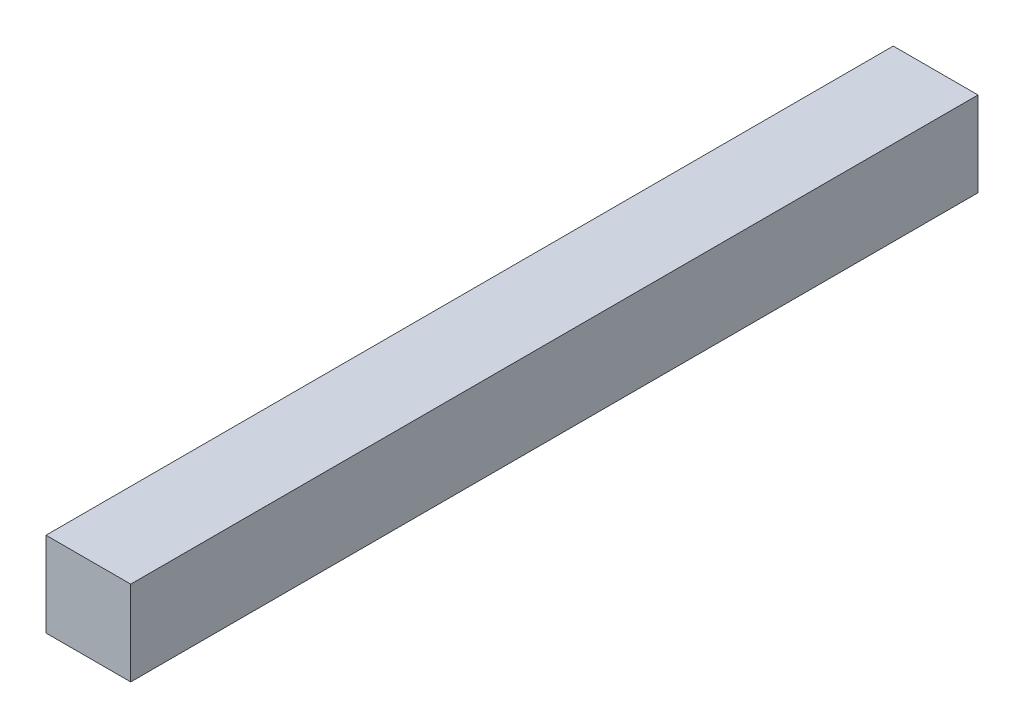
from build123d import *

# Parameters (mm, degrees)
SKETCH1_W           = 10
SKETCH1_H           = 10
BOSS_EXTRUDE1_DEPTH = 100


with BuildPart() as part:
    # Sketch1 → Boss-Extrude1 (new body)
    with BuildSketch(Plane.XY):
        Rectangle(SKETCH1_W, SKETCH1_H)
    extrude(amount=BOSS_EXTRUDE1_DEPTH)


solid = part.part
